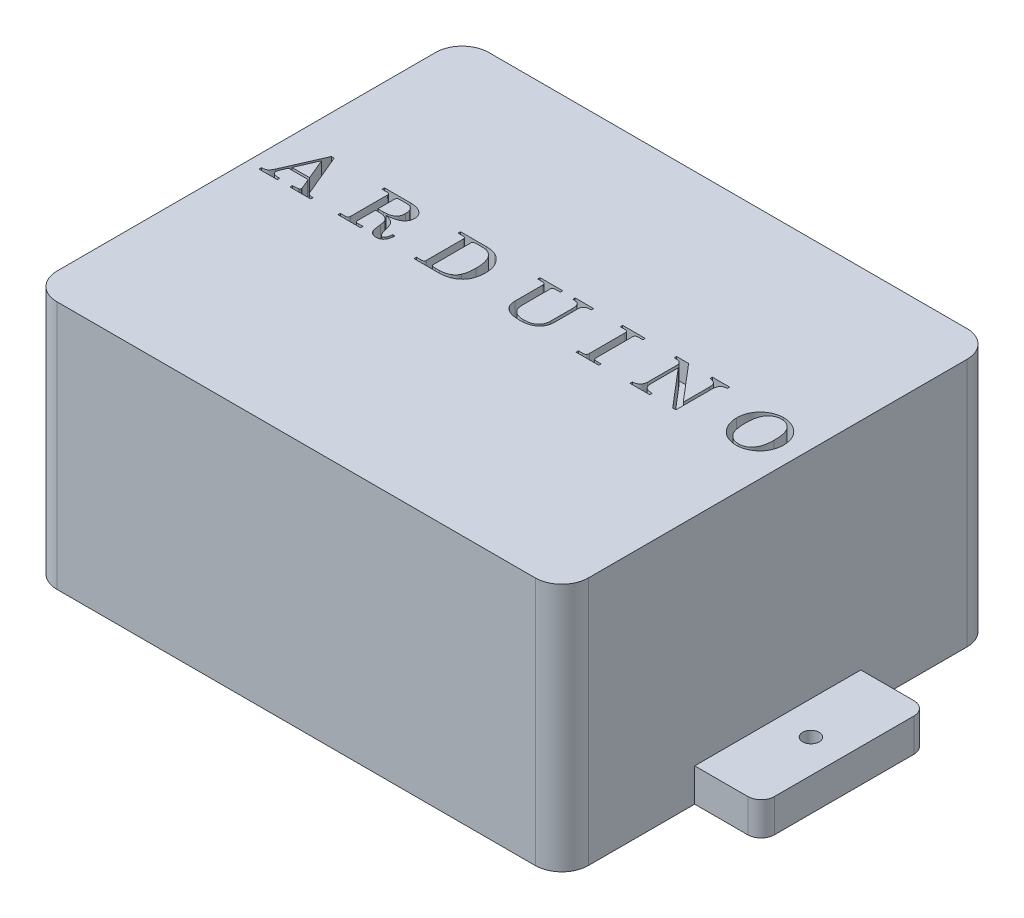
from build123d import *

# Parameters (mm, degrees)
SKETCH2_W           = 101.6
SKETCH2_H           = 82.55
BOSS_EXTRUDE1_DEPTH = 47.625
FILLET1_R           = 5.08
SKETCH4_W           = 12.7
SKETCH4_H           = 31.75
BOSS_EXTRUDE2_DEPTH = 6.35
SKETCH3_W           = 12.7
SKETCH3_H           = 31.75
BOSS_EXTRUDE3_DEPTH = 6.35
FILLET2_R           = 2.54
SKETCH5_W           = 31.75
SKETCH5_H           = 12.7
BOSS_EXTRUDE4_DEPTH = 6.35
FILLET3_R           = 2.54
SKETCH6_R           = 1.5875
CUT_EXTRUDE1_DEPTH  = 9.398
SKETCH7_R           = 1.5875
CUT_EXTRUDE2_DEPTH  = 9.398
SKETCH8_R           = 1.5875
CUT_EXTRUDE3_DEPTH  = 9.398
CUT_EXTRUDE4_DEPTH  = 3.81


with BuildPart() as part:
    # Sketch2 → Boss-Extrude1 (new body)
    with BuildSketch(Plane(origin=(0, 0, 0), x_dir=(1, 0, 0), z_dir=(0, 1, 0))):
        Rectangle(SKETCH2_W, SKETCH2_H)
    extrude(amount=BOSS_EXTRUDE1_DEPTH)

    # Fillet1
    fillet1_edges = [part.edges().sort_by_distance(p)[0] for p in [
        (-50.8, 23.8125, -41.275),
        (-50.8, 23.8125, 41.275),
        (50.8, 23.8125, 41.275),
        (50.8, 23.8125, -41.275),
    ]]
    fillet(fillet1_edges, radius=FILLET1_R)

    # Sketch4 → Boss-Extrude2 (add)
    with BuildSketch(Plane(origin=(0, 0, 0), x_dir=(1, 0, 0), z_dir=(0, 1, 0))):
        with Locations((-57.15, 0)):
            Rectangle(SKETCH4_W, SKETCH4_H)
    extrude(amount=BOSS_EXTRUDE2_DEPTH)

    # Sketch3 → Boss-Extrude3 (add)
    with BuildSketch(Plane(origin=(0, 0, 0), x_dir=(1, 0, 0), z_dir=(0, 1, 0))):
        with Locations((57.15, 0)):
            Rectangle(SKETCH3_W, SKETCH3_H)
    extrude(amount=BOSS_EXTRUDE3_DEPTH)

    # Fillet2
    fillet2_edges = [part.edges().sort_by_distance(p)[0] for p in [
        (-63.5, 3.175, -15.875),
        (-63.5, 3.175, 15.875),
        (63.5, 3.175, 15.875),
        (63.5, 3.175, -15.875),
    ]]
    fillet(fillet2_edges, radius=FILLET2_R)

    # Sketch5 → Boss-Extrude4 (add)
    with BuildSketch(Plane(origin=(0, 0, 0), x_dir=(1, 0, 0), z_dir=(0, 1, 0))):
        with Locations((0, 47.625)):
            Rectangle(SKETCH5_W, SKETCH5_H)
    extrude(amount=BOSS_EXTRUDE4_DEPTH)

    # Fillet3
    fillet3_edges = [part.edges().sort_by_distance(p)[0] for p in [
        (15.875, 3.175, -53.975),
        (-15.875, 3.175, -53.975),
    ]]
    fillet(fillet3_edges, radius=FILLET3_R)

    # Sketch6 → Cut-Extrude1 (cut)
    with BuildSketch(Plane(origin=(0, 6.35, 0), x_dir=(1, 0, 0), z_dir=(0, 1, 0))):
        with Locations(Location((0, 47.625, 0), (0, 0, 270))):
            Circle(SKETCH6_R)
    extrude(amount=-CUT_EXTRUDE1_DEPTH, mode=Mode.SUBTRACT)

    # Sketch7 → Cut-Extrude2 (cut)
    with BuildSketch(Plane(origin=(0, 6.35, 0), x_dir=(1, 0, 0), z_dir=(0, 1, 0))):
        with Locations(Location((-57.15, 0, 0), (0, 0, 270))):
            Circle(SKETCH7_R)
    extrude(amount=-CUT_EXTRUDE2_DEPTH, mode=Mode.SUBTRACT)

    # Sketch8 → Cut-Extrude3 (cut)
    with BuildSketch(Plane(origin=(0, 6.35, 0), x_dir=(1, 0, 0), z_dir=(0, 1, 0))):
        with Locations(Location((57.15, 0, 0), (0, 0, 270))):
            Circle(SKETCH8_R)
    extrude(amount=-CUT_EXTRUDE3_DEPTH, mode=Mode.SUBTRACT)

    # Sketch9 → Cut-Extrude4 (cut)
    # profile 1 of 7: a face of its own
    with BuildSketch(Plane(origin=(0, 47.625, 0), x_dir=(1, 0, 0), z_dir=(0, 1, 0))):
        with BuildLine():
            Line((-43.536424279, 9.003974359), (-42.989703526, 9.003974359))
            Line((-42.989703526, 9.003974359), (-39.622117388, 0.954535256))
            add(Edge.make_bspline(
                [(-39.622117388, 0.954535256), (-39.604002207, 0.914490083), (-39.5688485, 0.836779773), (-39.492223653, 0.736322955), (-39.407844046, 0.646018484), (-39.303777794, 0.578384667), (-39.190200079, 0.519918717), (-39.060178429, 0.485804808), (-38.918653338, 0.458207487), (-38.819118041, 0.456688218), (-38.767309696, 0.455897436)],
                knots=[0, 0, 0, 0, 0.994829911, 1.930533329, 2.855294756, 3.786422103, 4.733037038, 5.744176723, 6.825838908, 8, 8, 8, 8], degree=3))
            Line((-38.767309696, 0.455897436), (-38.466346154, 0.455897436))
            Line((-38.466346154, 0.455897436), (-38.466346154, 0))
            Line((-38.466346154, 0), (-42.455448718, 0))
            Line((-42.455448718, 0), (-42.455448718, 0.455897436))
            Line((-42.455448718, 0.455897436), (-42.136676683, 0.455897436))
            add(Edge.make_bspline(
                [(-42.136676683, 0.455897436), (-42.040411467, 0.456727966), (-41.862987376, 0.458258695), (-41.620429867, 0.481996759), (-41.420814343, 0.513991023), (-41.308710979, 0.557563734), (-41.258717949, 0.576995192)],
                knots=[0, 0, 0, 0, 1.294337848, 2.385562797, 3.280034022, 4, 4, 4, 4], degree=3))
            add(Edge.make_bspline(
                [(-41.258717949, 0.576995192), (-41.232122171, 0.591598971), (-41.181425583, 0.619436539), (-41.124537814, 0.682633624), (-41.087455546, 0.756805211), (-41.084120252, 0.811035153), (-41.082413862, 0.838780048)],
                knots=[0, 0, 0, 0, 1.083423217, 2.06520984, 3.010130791, 4, 4, 4, 4], degree=3))
            add(Edge.make_bspline(
                [(-41.082413862, 0.838780048), (-41.084970792, 0.874740677), (-41.090325562, 0.950050095), (-41.116710696, 1.02083813), (-41.130496795, 1.057824519)],
                knots=[0, 0, 0, 0, 0.955010143, 2, 2, 2, 2], degree=3))
            Line((-41.130496795, 1.057824519), (-41.926536458, 2.963333333))
            Line((-41.926536458, 2.963333333), (-45.694813702, 2.963333333))
            Line((-45.694813702, 2.963333333), (-46.173862179, 1.869891827))
            add(Edge.make_bspline(
                [(-46.173862179, 1.869891827), (-46.201088091, 1.80141011), (-46.251918871, 1.673554737), (-46.306931412, 1.488849421), (-46.34460872, 1.327062429), (-46.349645462, 1.225385744), (-46.351947115, 1.178922276)],
                knots=[0, 0, 0, 0, 1.231955945, 2.300061883, 3.2231747, 4, 4, 4, 4], degree=3))
            add(Edge.make_bspline(
                [(-46.351947115, 1.178922276), (-46.348066342, 1.130286407), (-46.340376604, 1.03391463), (-46.280592961, 0.895787578), (-46.18256579, 0.772425623), (-46.051157939, 0.658744225), (-45.881545579, 0.566388301), (-45.675991764, 0.502267979), (-45.438235852, 0.460954286), (-45.268196849, 0.457645452), (-45.178367388, 0.455897436)],
                knots=[0, 0, 0, 0, 0.762292442, 1.510479399, 2.32184449, 3.221058675, 4.222836197, 5.331659558, 6.5903494, 8, 8, 8, 8], degree=3))
            Line((-45.178367388, 0.455897436), (-44.848910256, 0.455897436))
            Line((-44.848910256, 0.455897436), (-44.848910256, 0))
            Line((-44.848910256, 0), (-48.382115385, 0))
            Line((-48.382115385, 0), (-48.382115385, 0.455897436))
            add(Edge.make_bspline(
                [(-48.382115385, 0.455897436), (-48.28815003, 0.45834966), (-48.109232276, 0.463018897), (-47.856196226, 0.505399238), (-47.633455259, 0.576064548), (-47.436060528, 0.678313489), (-47.259326621, 0.825133979), (-47.099990361, 1.022066475), (-46.940655653, 1.264167045), (-46.852919173, 1.450062102), (-46.806063702, 1.549338942)],
                knots=[0, 0, 0, 0, 1.090629389, 2.076647962, 2.968307612, 3.794769303, 4.642156667, 5.615757963, 6.72670086, 8, 8, 8, 8], degree=3))
            Line((-46.806063702, 1.549338942), (-43.536424279, 9.003974359))
        make_face()
        Polygon((-43.766153846, 7.36203125), (-45.493577724, 3.419230769), (-42.11708734, 3.419230769), align=None, mode=Mode.SUBTRACT)
    # profile 2 of 7: a face of its own
    with BuildSketch(Plane(origin=(0, 47.625, 0), x_dir=(1, 0, 0), z_dir=(0, 1, 0))):
        with BuildLine():
            Line((-33.280512821, 8.89), (-28.329751603, 8.89))
            add(Edge.make_bspline(
                [(-28.329751603, 8.89), (-28.213340327, 8.888523822), (-27.986676756, 8.885649566), (-27.65650361, 8.856654885), (-27.345707861, 8.80942446), (-27.055301867, 8.741677323), (-26.784754222, 8.657208281), (-26.535242629, 8.55095034), (-26.304495692, 8.427372869), (-26.09662607, 8.281880432), (-25.908721133, 8.12503902), (-25.747864924, 7.952061653), (-25.608917253, 7.769889459), (-25.495389293, 7.574643085), (-25.410117031, 7.365590905), (-25.347590337, 7.145926219), (-25.309065318, 6.914010907), (-25.30459087, 6.755504519), (-25.302307692, 6.674623397)],
                knots=[0, 0, 0, 0, 1.325337586, 2.580555424, 3.770824207, 4.902205483, 5.973254357, 6.993995562, 7.986110769, 8.948036827, 9.878475906, 10.767990268, 11.631887648, 12.48291557, 13.331523885, 14.195976461, 15.079460148, 16, 16, 16, 16], degree=3))
            add(Edge.make_bspline(
                [(-25.302307692, 6.674623397), (-25.306565576, 6.578149212), (-25.314931635, 6.388592905), (-25.376696516, 6.112147407), (-25.481543929, 5.852790412), (-25.626686554, 5.611426313), (-25.810893301, 5.390499895), (-26.031589015, 5.191177923), (-26.291445572, 5.019166852), (-26.533603961, 4.894128933), (-26.752425313, 4.807898642), (-26.940564903, 4.745406872), (-27.151706446, 4.691678618), (-27.383883414, 4.639863656), (-27.638593033, 4.591756713), (-27.916045669, 4.549679206), (-28.215324798, 4.512128559), (-28.422296121, 4.49252435), (-28.529206731, 4.482397837)],
                knots=[0, 0, 0, 0, 1.067088767, 2.096658329, 3.116436782, 4.150627256, 5.200286254, 6.288636011, 7.429161393, 8.639564393, 9.297052383, 10.030338999, 10.831780319, 11.706736611, 12.662696747, 13.69951255, 14.811687946, 16, 16, 16, 16], degree=3))
            add(Edge.make_bspline(
                [(-28.529206731, 4.482397837), (-28.455468641, 4.463271116), (-28.314081565, 4.426597112), (-28.112227106, 4.366344536), (-27.926617971, 4.311122903), (-27.76024501, 4.251909171), (-27.610977624, 4.194839042), (-27.479671223, 4.139001646), (-27.366250362, 4.081507677), (-27.239032646, 4.006465249), (-27.099526538, 3.903660233), (-26.949769136, 3.765870362), (-26.819710292, 3.609632254), (-26.723602186, 3.464275942), (-26.653470822, 3.330087637), (-26.597979506, 3.205888715), (-26.542292077, 3.058607602), (-26.482945766, 2.88834991), (-26.423363604, 2.695036089), (-26.361089626, 2.478158521), (-26.294841048, 2.239302661), (-26.253437116, 2.071241701), (-26.231911058, 1.983866186)],
                knots=[0, 0, 0, 0, 1.236432709, 2.370763958, 3.419256797, 4.37922064, 5.236377294, 6.013243618, 6.694123341, 7.298959475, 8.409090308, 9.500027509, 10.594363806, 11.700808435, 12.321479266, 13.050371871, 13.907528525, 14.876589473, 15.976806725, 17.190540236, 18.539351455, 20, 20, 20, 20], degree=3))
            add(Edge.make_bspline(
                [(-26.231911058, 1.983866186), (-26.20040644, 1.861638913), (-26.141475714, 1.63300761), (-26.033609919, 1.321309378), (-25.926469708, 1.058315167), (-25.834269957, 0.911407999), (-25.792041266, 0.844122596)],
                knots=[0, 0, 0, 0, 1.233367696, 2.307066631, 3.224614386, 4, 4, 4, 4], degree=3))
            add(Edge.make_bspline(
                [(-25.792041266, 0.844122596), (-25.76146001, 0.803013911), (-25.704667232, 0.726670531), (-25.603389792, 0.638786712), (-25.497097131, 0.581216745), (-25.422239609, 0.573571966), (-25.386007612, 0.569871795)],
                knots=[0, 0, 0, 0, 1.205711473, 2.239139682, 3.147721125, 4, 4, 4, 4], degree=3))
            add(Edge.make_bspline(
                [(-25.386007612, 0.569871795), (-25.348587458, 0.574132784), (-25.271033158, 0.582963802), (-25.159895613, 0.643734098), (-25.058566553, 0.742843215), (-24.979089928, 0.850021788), (-24.920004376, 0.956379423), (-24.879122515, 1.054523442), (-24.841994237, 1.166352335), (-24.8102445, 1.293197404), (-24.784352162, 1.434320206), (-24.760880738, 1.589239188), (-24.74324788, 1.758605549), (-24.736131933, 1.876387788), (-24.732435897, 1.937564103)],
                knots=[0, 0, 0, 0, 0.821559311, 1.702704273, 2.718209026, 3.921172205, 4.621965979, 5.387759944, 6.254196208, 7.209853525, 8.258997706, 9.406706446, 10.653038495, 12, 12, 12, 12], degree=3))
            Line((-24.732435897, 1.937564103), (-24.276538462, 1.937564103))
            add(Edge.make_bspline(
                [(-24.276538462, 1.937564103), (-24.282808592, 1.854968741), (-24.295021401, 1.694091495), (-24.326897952, 1.461553748), (-24.369747308, 1.244516198), (-24.422161392, 1.043651033), (-24.486912883, 0.858636438), (-24.560651217, 0.689394506), (-24.646988807, 0.535902243), (-24.744384233, 0.399217155), (-24.852795482, 0.27765451), (-24.971535589, 0.172614637), (-25.102323641, 0.084207185), (-25.242814594, 0.010357366), (-25.396164381, -0.043804498), (-25.558594491, -0.085905287), (-25.732667331, -0.108148586), (-25.85194247, -0.111998885), (-25.913139022, -0.113974359)],
                knots=[0, 0, 0, 0, 1.346462126, 2.622606342, 3.813111985, 4.94143984, 5.99444776, 6.99688579, 7.938971902, 8.852192047, 9.720181315, 10.581762286, 11.422275858, 12.281258439, 13.154436485, 14.060283573, 15.004788775, 16, 16, 16, 16], degree=3))
            add(Edge.make_bspline(
                [(-25.913139022, -0.113974359), (-25.989902468, -0.111255758), (-26.139234151, -0.105967131), (-26.355879723, -0.064260743), (-26.556323942, 0.005117309), (-26.74090832, 0.101992634), (-26.90525136, 0.227705853), (-27.049929148, 0.378942869), (-27.170800625, 0.558472948), (-27.231667306, 0.691759817), (-27.263022837, 0.760422676)],
                knots=[0, 0, 0, 0, 1.073046045, 2.087448933, 3.07206062, 4.030240904, 4.990002463, 5.953061936, 6.945517869, 8, 8, 8, 8], degree=3))
            add(Edge.make_bspline(
                [(-27.263022837, 0.760422676), (-27.275434131, 0.792893743), (-27.303897317, 0.867360592), (-27.337712553, 0.998276604), (-27.372416357, 1.16140789), (-27.412377641, 1.356987635), (-27.450480346, 1.585790911), (-27.489459077, 1.847122774), (-27.530417925, 2.140979908), (-27.557067471, 2.348319668), (-27.571109776, 2.457572115)],
                knots=[0, 0, 0, 0, 0.482554285, 1.106655889, 1.874902701, 2.79986758, 3.878891763, 5.096322143, 6.469980334, 8, 8, 8, 8], degree=3))
            add(Edge.make_bspline(
                [(-27.571109776, 2.457572115), (-27.579494093, 2.521764047), (-27.59560238, 2.645092171), (-27.627252966, 2.822305312), (-27.657235266, 2.985746066), (-27.695767707, 3.134526947), (-27.735555432, 3.26923789), (-27.780258401, 3.389397408), (-27.827947226, 3.495047077), (-27.896920531, 3.616920629), (-28.002325794, 3.753257371), (-28.155938606, 3.897874501), (-28.341909806, 4.022609268), (-28.553198553, 4.133170163), (-28.791956364, 4.221434542), (-29.05368441, 4.284741067), (-29.337058268, 4.325073707), (-29.533461816, 4.328995726), (-29.635114183, 4.331025641)],
                knots=[0, 0, 0, 0, 0.982635714, 1.887879316, 2.732700714, 3.504264558, 4.219851532, 4.864317877, 5.449055353, 5.977774836, 6.987156041, 8.051828256, 9.166693456, 10.375944424, 11.664877114, 13.020033355, 14.457661972, 16, 16, 16, 16], degree=3))
            Line((-29.635114183, 4.331025641), (-30.431153846, 4.331025641))
            Line((-30.431153846, 4.331025641), (-30.431153846, 0.877958734))
            add(Edge.make_bspline(
                [(-30.431153846, 0.877958734), (-30.430211121, 0.843926931), (-30.42844794, 0.780277148), (-30.404701754, 0.69315065), (-30.368055558, 0.619819003), (-30.330199594, 0.584986851), (-30.311836939, 0.568090946)],
                knots=[0, 0, 0, 0, 1.184932624, 2.216183006, 3.134730392, 4, 4, 4, 4], degree=3))
            add(Edge.make_bspline(
                [(-30.311836939, 0.568090946), (-30.284033213, 0.549984359), (-30.224262562, 0.511059992), (-30.113134623, 0.481678536), (-29.984563955, 0.458663939), (-29.891713184, 0.456866013), (-29.841692708, 0.455897436)],
                knots=[0, 0, 0, 0, 0.806637898, 1.73405794, 2.779293934, 4, 4, 4, 4], degree=3))
            Line((-29.841692708, 0.455897436), (-28.949487179, 0.455897436))
            Line((-28.949487179, 0.455897436), (-28.949487179, 0))
            Line((-28.949487179, 0), (-33.280512821, 0))
            Line((-33.280512821, 0), (-33.280512821, 0.455897436))
            Line((-33.280512821, 0.455897436), (-32.377622196, 0.455897436))
            add(Edge.make_bspline(
                [(-32.377622196, 0.455897436), (-32.331239913, 0.457137352), (-32.243850884, 0.459473483), (-32.122900591, 0.479626371), (-32.021100193, 0.515356427), (-31.939158818, 0.565875895), (-31.874628588, 0.628796126), (-31.831833866, 0.704579388), (-31.802964011, 0.789239648), (-31.800261776, 0.849796481), (-31.798846154, 0.881520433)],
                knots=[0, 0, 0, 0, 1.366320197, 2.574288932, 3.598095376, 4.525274064, 5.391179792, 6.222279922, 7.068704523, 8, 8, 8, 8], degree=3))
            Line((-31.798846154, 0.881520433), (-31.798846154, 7.978205128))
            add(Edge.make_bspline(
                [(-31.798846154, 7.978205128), (-31.80038642, 8.013983669), (-31.803311214, 8.081923118), (-31.829893015, 8.177704503), (-31.877686165, 8.257710354), (-31.941912548, 8.32423997), (-32.025226111, 8.375000461), (-32.126653575, 8.409522285), (-32.24614707, 8.430832484), (-32.331812401, 8.432963172), (-32.377622196, 8.434102564)],
                knots=[0, 0, 0, 0, 1.019835337, 1.936553289, 2.80224376, 3.652720564, 4.550463343, 5.557701521, 6.693973527, 8, 8, 8, 8], degree=3))
            Line((-32.377622196, 8.434102564), (-33.280512821, 8.434102564))
            Line((-33.280512821, 8.434102564), (-33.280512821, 8.89))
        make_face()
        with BuildLine():
            Line((-30.431153846, 4.786923077), (-29.343054888, 4.786923077))
            add(Edge.make_bspline(
                [(-29.343054888, 4.786923077), (-29.254587816, 4.788581977), (-29.082223527, 4.791814085), (-28.830504157, 4.808454931), (-28.594146317, 4.841497063), (-28.371596876, 4.882519852), (-28.165156473, 4.940892462), (-27.971498476, 5.006541634), (-27.795095868, 5.090256936), (-27.630427377, 5.181584321), (-27.483551586, 5.291755026), (-27.356364099, 5.422805219), (-27.249050026, 5.573560637), (-27.161975135, 5.744222354), (-27.093795013, 5.933299333), (-27.047023173, 6.142105201), (-27.015582953, 6.369738764), (-27.013170025, 6.528479251), (-27.011923077, 6.610512821)],
                knots=[0, 0, 0, 0, 1.2479382, 2.431412908, 3.555094835, 4.612540209, 5.620016077, 6.5785745, 7.492548499, 8.37005512, 9.230745153, 10.071494986, 10.935761083, 11.830708422, 12.765610627, 13.762771068, 14.843849608, 16, 16, 16, 16], degree=3))
            add(Edge.make_bspline(
                [(-27.011923077, 6.610512821), (-27.014178507, 6.721692239), (-27.018468727, 6.93317486), (-27.063181423, 7.23205609), (-27.134357768, 7.495159376), (-27.236454487, 7.721880249), (-27.364797569, 7.911013997), (-27.507361865, 8.072896472), (-27.67414881, 8.196013007), (-27.828860346, 8.275431282), (-27.970320441, 8.321932232), (-28.100426074, 8.351375917), (-28.252553656, 8.377753508), (-28.427916554, 8.398783663), (-28.625809767, 8.413880604), (-28.846648351, 8.426683585), (-29.090724048, 8.433546492), (-29.261132042, 8.433911717), (-29.350178285, 8.434102564)],
                knots=[0, 0, 0, 0, 1.523576127, 2.898107215, 4.132521921, 5.250819719, 6.289334486, 7.257415311, 8.193517659, 9.114527787, 9.629347882, 10.23154437, 10.942154632, 11.745834806, 12.652342215, 13.663311778, 14.778969804, 16, 16, 16, 16], degree=3))
            add(Edge.make_bspline(
                [(-29.350178285, 8.434102564), (-29.408348783, 8.433544666), (-29.518764782, 8.432485694), (-29.676225023, 8.430425762), (-29.815658354, 8.420484251), (-29.938192301, 8.410924962), (-30.042593885, 8.396137828), (-30.131250551, 8.381670178), (-30.201595058, 8.360745297), (-30.271207437, 8.331039788), (-30.336097825, 8.278574915), (-30.393351691, 8.2003346), (-30.426292227, 8.102279154), (-30.429459616, 8.031885969), (-30.431153846, 7.994232772)],
                knots=[0, 0, 0, 0, 1.586941608, 3.012244179, 4.294006373, 5.399370131, 6.363466356, 7.170168388, 7.846384482, 8.360988235, 9.225882761, 10.084234759, 10.975260392, 12, 12, 12, 12], degree=3))
            Line((-30.431153846, 7.994232772), (-30.431153846, 4.786923077))
        make_face(mode=Mode.SUBTRACT)
    # profile 3 of 7: a face of its own
    with BuildSketch(Plane(origin=(0, 47.625, 0), x_dir=(1, 0, 0), z_dir=(0, 1, 0))):
        with BuildLine():
            Line((-18.748782051, 8.89), (-13.739252804, 8.89))
            add(Edge.make_bspline(
                [(-13.739252804, 8.89), (-13.647801009, 8.889200098), (-13.46886916, 8.887635033), (-13.205684337, 8.868720391), (-12.953069872, 8.840871286), (-12.710606263, 8.801550318), (-12.478321535, 8.752628806), (-12.25705173, 8.689037771), (-12.044758201, 8.618225409), (-11.910480428, 8.558075411), (-11.844429087, 8.52848758)],
                knots=[0, 0, 0, 0, 1.128854498, 2.20868295, 3.255962748, 4.265640905, 5.240237995, 6.184520583, 7.106964267, 8, 8, 8, 8], degree=3))
            add(Edge.make_bspline(
                [(-11.844429087, 8.52848758), (-11.764108127, 8.488942416), (-11.603347847, 8.409793815), (-11.374708691, 8.264626301), (-11.154220823, 8.103233893), (-10.942199852, 7.922302791), (-10.742624471, 7.720272285), (-10.547986832, 7.502433458), (-10.366146938, 7.262994157), (-10.191007456, 7.008422719), (-10.03397199, 6.736683761), (-9.892717304, 6.452945456), (-9.778961102, 6.154459564), (-9.680837748, 5.845868166), (-9.609289793, 5.523762666), (-9.555458982, 5.190267628), (-9.522799077, 4.843966956), (-9.518859758, 4.608907922), (-9.516858974, 4.489521234)],
                knots=[0, 0, 0, 0, 0.873369389, 1.748025758, 2.639281441, 3.539309685, 4.4653202, 5.409464513, 6.388818265, 7.398141486, 8.423799729, 9.450030714, 10.488442667, 11.538606627, 12.608347628, 13.705790979, 14.834769239, 16, 16, 16, 16], degree=3))
            add(Edge.make_bspline(
                [(-9.516858974, 4.489521234), (-9.518522432, 4.390367682), (-9.521802152, 4.194873802), (-9.538960616, 3.905329254), (-9.571538138, 3.623727845), (-9.615777275, 3.349106526), (-9.672971211, 3.081684859), (-9.741582823, 2.821455665), (-9.82590628, 2.569878366), (-9.890690447, 2.406833674), (-9.922892628, 2.325789263)],
                knots=[0, 0, 0, 0, 1.073908748, 2.117348133, 3.139660485, 4.14264811, 5.128659546, 6.100166453, 7.055652226, 8, 8, 8, 8], degree=3))
            add(Edge.make_bspline(
                [(-9.922892628, 2.325789263), (-9.978156182, 2.204935017), (-10.088672236, 1.963250696), (-10.308025133, 1.626558325), (-10.56804271, 1.313606871), (-10.867305899, 1.025032344), (-11.205149402, 0.765875645), (-11.580172858, 0.541446626), (-11.989038139, 0.348619635), (-12.280152468, 0.253357463), (-12.428547676, 0.204797676)],
                knots=[0, 0, 0, 0, 0.938742659, 1.87729757, 2.831356061, 3.811095414, 4.811112603, 5.835599115, 6.896699036, 8, 8, 8, 8], degree=3))
            add(Edge.make_bspline(
                [(-12.428547676, 0.204797676), (-12.488335048, 0.1880899), (-12.611269704, 0.153735408), (-12.805389293, 0.113801746), (-13.013137489, 0.077725146), (-13.23611178, 0.050260061), (-13.47296358, 0.026608278), (-13.724230875, 0.010955348), (-13.989698093, 0.00239672), (-14.171399395, 0.000812585), (-14.264603365, 0)],
                knots=[0, 0, 0, 0, 0.803661782, 1.652487486, 2.564925393, 3.533654074, 4.560912339, 5.647000953, 6.793025422, 8, 8, 8, 8], degree=3))
            Line((-14.264603365, 0), (-18.748782051, 0))
            Line((-18.748782051, 0), (-18.748782051, 0.455897436))
            Line((-18.748782051, 0.455897436), (-17.861919071, 0.455897436))
            add(Edge.make_bspline(
                [(-17.861919071, 0.455897436), (-17.810240206, 0.457402621), (-17.715427654, 0.460164107), (-17.585056663, 0.476089177), (-17.479879456, 0.507390837), (-17.396532324, 0.552059156), (-17.336930196, 0.61464906), (-17.295067298, 0.689287504), (-17.272183203, 0.778727444), (-17.268881725, 0.842212446), (-17.267115385, 0.876177885)],
                knots=[0, 0, 0, 0, 1.479128524, 2.713680912, 3.745072478, 4.604546806, 5.38523546, 6.183642314, 7.028221118, 8, 8, 8, 8], degree=3))
            Line((-17.267115385, 0.876177885), (-17.267115385, 8.026288061))
            add(Edge.make_bspline(
                [(-17.267115385, 8.026288061), (-17.268994562, 8.055490513), (-17.27267177, 8.112634366), (-17.296496385, 8.194797901), (-17.34464531, 8.264194175), (-17.405471344, 8.325478654), (-17.482185361, 8.375664776), (-17.574314014, 8.408762105), (-17.678639077, 8.430791616), (-17.753157775, 8.432959185), (-17.792465946, 8.434102564)],
                knots=[0, 0, 0, 0, 0.937952034, 1.835400481, 2.701595091, 3.617244345, 4.59439305, 5.612970742, 6.740856268, 8, 8, 8, 8], degree=3))
            Line((-17.792465946, 8.434102564), (-18.748782051, 8.434102564))
            Line((-18.748782051, 8.434102564), (-18.748782051, 8.89))
        make_face()
        with BuildLine():
            add(Edge.make_bspline(
                [(-15.325989583, 8.434102564), (-15.371798299, 8.432960938), (-15.457461615, 8.430826071), (-15.576968235, 8.409543078), (-15.678354143, 8.374935116), (-15.761445986, 8.324665441), (-15.824617311, 8.258040516), (-15.867619039, 8.176645391), (-15.895225419, 8.082065349), (-15.897975054, 8.014032733), (-15.899423077, 7.978205128)],
                knots=[0, 0, 0, 0, 1.310688048, 2.451015729, 3.461849022, 4.362796097, 5.2045471, 6.056534608, 6.976524584, 8, 8, 8, 8], degree=3))
            Line((-15.899423077, 7.978205128), (-15.899423077, 0.893986378))
            add(Edge.make_bspline(
                [(-15.899423077, 0.893986378), (-15.897548614, 0.859857722), (-15.89397792, 0.794845485), (-15.861729221, 0.703959625), (-15.811401314, 0.624843285), (-15.736142672, 0.560166479), (-15.635683637, 0.511908287), (-15.508635306, 0.480274227), (-15.354599491, 0.458935675), (-15.242379095, 0.456963241), (-15.181740785, 0.455897436)],
                knots=[0, 0, 0, 0, 0.856306403, 1.6311921, 2.397824084, 3.191915919, 4.093923673, 5.177590192, 6.474910384, 8, 8, 8, 8], degree=3))
            Line((-15.181740785, 0.455897436), (-14.360769231, 0.455897436))
            add(Edge.make_bspline(
                [(-14.360769231, 0.455897436), (-14.270498306, 0.457884176), (-14.092632555, 0.461798758), (-13.829508091, 0.484559495), (-13.574922743, 0.525746779), (-13.328599346, 0.582787715), (-13.090548104, 0.655162154), (-12.862961378, 0.747387326), (-12.641418968, 0.851414139), (-12.502072305, 0.935479106), (-12.432109375, 0.977686298)],
                knots=[0, 0, 0, 0, 1.069971775, 2.108224046, 3.127228152, 4.123885653, 5.103057016, 6.072448486, 7.032218285, 8, 8, 8, 8], degree=3))
            add(Edge.make_bspline(
                [(-12.432109375, 0.977686298), (-12.344922135, 1.039062337), (-12.171028178, 1.161476147), (-11.950326493, 1.395142869), (-11.757095313, 1.658604293), (-11.660446414, 1.856295048), (-11.611137821, 1.957153446)],
                knots=[0, 0, 0, 0, 0.985415046, 1.965399071, 2.96198186, 4, 4, 4, 4], degree=3))
            add(Edge.make_bspline(
                [(-11.611137821, 1.957153446), (-11.579641808, 2.030893058), (-11.514576092, 2.183227286), (-11.438114577, 2.428046975), (-11.37204221, 2.692040689), (-11.319514467, 2.976498454), (-11.276634373, 3.280647527), (-11.24696895, 3.605730257), (-11.228942674, 3.950902322), (-11.227311787, 4.187940923), (-11.226474359, 4.309655449)],
                knots=[0, 0, 0, 0, 0.80120648, 1.655164237, 2.56053185, 3.520798587, 4.545578828, 5.630395886, 6.783256233, 8, 8, 8, 8], degree=3))
            add(Edge.make_bspline(
                [(-11.226474359, 4.309655449), (-11.228578785, 4.488410063), (-11.232653287, 4.834507327), (-11.271972622, 5.334696974), (-11.336721373, 5.798366191), (-11.428994198, 6.224562934), (-11.54494911, 6.615182788), (-11.690156706, 6.968054155), (-11.857964273, 7.28710858), (-11.998626137, 7.472906673), (-12.067035256, 7.563267228)],
                knots=[0, 0, 0, 0, 1.253239079, 2.426469483, 3.515491727, 4.533593932, 5.481684897, 6.368298549, 7.206442619, 8, 8, 8, 8], degree=3))
            add(Edge.make_bspline(
                [(-12.067035256, 7.563267228), (-12.128701447, 7.633392286), (-12.251439897, 7.772967001), (-12.468996083, 7.949554725), (-12.707128348, 8.099715836), (-12.96790185, 8.224275601), (-13.252578974, 8.317317433), (-13.558611197, 8.384570748), (-13.887110007, 8.426283103), (-14.113696675, 8.43143878), (-14.230767228, 8.434102564)],
                knots=[0, 0, 0, 0, 0.927471519, 1.846010217, 2.774815188, 3.722955891, 4.712549021, 5.746842689, 6.835861021, 8, 8, 8, 8], degree=3))
            Line((-14.230767228, 8.434102564), (-15.325989583, 8.434102564))
        make_face(mode=Mode.SUBTRACT)
    # profile 4 of 7: a face of its own
    with BuildSketch(Plane(origin=(0, 47.625, 0), x_dir=(1, 0, 0), z_dir=(0, 1, 0))):
        with BuildLine():
            Line((-3.533205128, 8.89), (0.797820513, 8.89))
            Line((0.797820513, 8.89), (0.797820513, 8.434102564))
            Line((0.797820513, 8.434102564), (-0.062329728, 8.434102564))
            add(Edge.make_bspline(
                [(-0.062329728, 8.434102564), (-0.115798261, 8.432735144), (-0.214256181, 8.430217153), (-0.350206987, 8.412516459), (-0.460224727, 8.377700279), (-0.547279764, 8.328903243), (-0.610549978, 8.263404114), (-0.654691672, 8.183685142), (-0.678794783, 8.089393621), (-0.682109977, 8.022264885), (-0.683846154, 7.987109375)],
                knots=[0, 0, 0, 0, 1.457371901, 2.683630832, 3.722116912, 4.584977252, 5.374344441, 6.170971849, 7.042132742, 8, 8, 8, 8], degree=3))
            Line((-0.683846154, 7.987109375), (-0.683846154, 2.879633413))
            add(Edge.make_bspline(
                [(-0.683846154, 2.879633413), (-0.683671799, 2.814921194), (-0.683334167, 2.68960859), (-0.675975276, 2.507284293), (-0.664224163, 2.337328499), (-0.645605823, 2.179490392), (-0.625503145, 2.034233397), (-0.598413193, 1.901115625), (-0.566995241, 1.780344867), (-0.541213937, 1.704733966), (-0.52891226, 1.668655849)],
                knots=[0, 0, 0, 0, 1.26598702, 2.451532826, 3.569443726, 4.598059717, 5.560557243, 6.437477292, 7.25443453, 8, 8, 8, 8], degree=3))
            add(Edge.make_bspline(
                [(-0.52891226, 1.668655849), (-0.509146458, 1.618922891), (-0.469941543, 1.52027896), (-0.393166841, 1.380373439), (-0.306588226, 1.24735545), (-0.208378924, 1.121495487), (-0.096166414, 1.005443623), (0.025785422, 0.895088574), (0.160832159, 0.793281624), (0.306413168, 0.698323439), (0.465340894, 0.615129391), (0.635078037, 0.542213871), (0.81566162, 0.478905577), (1.009194332, 0.430757444), (1.213167602, 0.388001853), (1.430202106, 0.363771313), (1.657612538, 0.344110254), (1.813448979, 0.342662514), (1.893042869, 0.341923077)],
                knots=[0, 0, 0, 0, 0.870361103, 1.72633687, 2.591965376, 3.452130061, 4.32007431, 5.216382593, 6.126592765, 7.069994713, 8.042488186, 9.042247806, 10.075078372, 11.153110645, 12.286284334, 13.464375872, 14.704923022, 16, 16, 16, 16], degree=3))
            add(Edge.make_bspline(
                [(1.893042869, 0.341923077), (2.002921145, 0.344166531), (2.215934739, 0.348515763), (2.525567545, 0.376530249), (2.815305357, 0.425545998), (3.084649556, 0.497721044), (3.335741852, 0.585017781), (3.565017015, 0.696777641), (3.774838804, 0.82637564), (3.962777363, 0.977482641), (4.129913674, 1.144197152), (4.274877825, 1.325625463), (4.400155615, 1.519132371), (4.498254505, 1.728396237), (4.578882403, 1.949658277), (4.632165282, 2.18546957), (4.667710648, 2.433931892), (4.671179158, 2.604065061), (4.672948718, 2.690863381)],
                knots=[0, 0, 0, 0, 1.278948243, 2.479410588, 3.615362396, 4.694698649, 5.721884643, 6.704603805, 7.657477578, 8.586581247, 9.505116446, 10.399689619, 11.285224436, 12.18147716, 13.084099542, 14.02098127, 14.990346785, 16, 16, 16, 16], degree=3))
            Line((4.672948718, 2.690863381), (4.672948718, 6.843804087))
            add(Edge.make_bspline(
                [(4.672948718, 6.843804087), (4.671801298, 6.929888319), (4.66964712, 7.091503743), (4.65725021, 7.31769288), (4.630838479, 7.51051689), (4.595231398, 7.673258135), (4.550338578, 7.811036291), (4.49680198, 7.931032372), (4.432617849, 8.034105555), (4.360327916, 8.12411854), (4.277062721, 8.198961746), (4.185358001, 8.264188018), (4.082787637, 8.317635424), (3.965897237, 8.361950018), (3.823957914, 8.397031046), (3.647664059, 8.417161551), (3.432528652, 8.431463148), (3.276202963, 8.433173466), (3.191282051, 8.434102564)],
                knots=[0, 0, 0, 0, 1.595289402, 2.995012738, 4.194377291, 5.197759292, 6.077799386, 6.875254456, 7.626136128, 8.321901517, 9.007065315, 9.693728476, 10.402245455, 11.143804078, 12.005505098, 13.103818099, 14.426705109, 16, 16, 16, 16], degree=3))
            Line((3.191282051, 8.434102564), (3.191282051, 8.89))
            Line((3.191282051, 8.89), (6.724487179, 8.89))
            Line((6.724487179, 8.89), (6.724487179, 8.434102564))
            Line((6.724487179, 8.434102564), (6.462702324, 8.434102564))
            add(Edge.make_bspline(
                [(6.462702324, 8.434102564), (6.412800766, 8.433026636), (6.316348644, 8.430947031), (6.176492083, 8.416411904), (6.04658373, 8.393763606), (5.925918763, 8.36183739), (5.814896092, 8.319758363), (5.715247804, 8.264931124), (5.622656673, 8.205324046), (5.516100269, 8.109068488), (5.403002402, 7.965824984), (5.307850068, 7.759214804), (5.253392611, 7.519137977), (5.246471626, 7.348670696), (5.242820513, 7.258741987)],
                knots=[0, 0, 0, 0, 0.926262674, 1.79032488, 2.607434735, 3.371949735, 4.104587355, 4.804677008, 5.480135518, 6.143622011, 7.461964485, 8.837380035, 10.331584045, 12, 12, 12, 12], degree=3))
            Line((5.242820513, 7.258741987), (5.242820513, 2.918812099))
            add(Edge.make_bspline(
                [(5.242820513, 2.918812099), (5.240081339, 2.803528146), (5.234754186, 2.57932358), (5.193629083, 2.253590407), (5.124548289, 1.948475233), (5.026424369, 1.66427994), (4.901253051, 1.399676311), (4.747204855, 1.156220778), (4.565263085, 0.932923767), (4.423557282, 0.803863587), (4.352395833, 0.739052484)],
                knots=[0, 0, 0, 0, 1.136692078, 2.210642051, 3.231720009, 4.216663715, 5.169830349, 6.111839143, 7.051808325, 8, 8, 8, 8], degree=3))
            add(Edge.make_bspline(
                [(4.352395833, 0.739052484), (4.267039625, 0.670764251), (4.095439443, 0.533477538), (3.812267038, 0.359165389), (3.508060074, 0.212991958), (3.183867047, 0.094255538), (2.840057761, -0.001868636), (2.474236624, -0.064977388), (2.088790507, -0.10832477), (1.824904781, -0.112063433), (1.690026042, -0.113974359)],
                knots=[0, 0, 0, 0, 0.918044137, 1.845636599, 2.78729075, 3.750195265, 4.743923444, 5.783209084, 6.8669415, 8, 8, 8, 8], degree=3))
            add(Edge.make_bspline(
                [(1.690026042, -0.113974359), (1.573055549, -0.113201008), (1.346092066, -0.111700438), (1.015261966, -0.092899672), (0.703223668, -0.065386341), (0.410049071, -0.025152825), (0.136179554, 0.028744954), (-0.118416092, 0.092333739), (-0.354622357, 0.166216338), (-0.571366558, 0.254468152), (-0.771991519, 0.352563661), (-0.957725261, 0.46146851), (-1.129548336, 0.580102071), (-1.284687189, 0.712359182), (-1.429505302, 0.849672133), (-1.559086543, 0.999177964), (-1.673302026, 1.159231248), (-1.737892319, 1.273300715), (-1.770164263, 1.330294471)],
                knots=[0, 0, 0, 0, 1.422495068, 2.760135736, 4.028896878, 5.231706749, 6.357393975, 7.422061231, 8.422174171, 9.364702629, 10.265577661, 11.136083296, 11.981310976, 12.801276094, 13.613159394, 14.406467317, 15.203806119, 16, 16, 16, 16], degree=3))
            add(Edge.make_bspline(
                [(-1.770164263, 1.330294471), (-1.814048564, 1.423581775), (-1.904676925, 1.616235527), (-1.987504162, 1.938004403), (-2.042856578, 2.291191996), (-2.048562489, 2.538648862), (-2.051538462, 2.66771234)],
                knots=[0, 0, 0, 0, 0.895223759, 1.848785523, 2.878013669, 4, 4, 4, 4], degree=3))
            Line((-2.051538462, 2.66771234), (-2.051538462, 7.997794471))
            add(Edge.make_bspline(
                [(-2.051538462, 7.997794471), (-2.052953928, 8.030079592), (-2.055689997, 8.092486094), (-2.08515705, 8.180025662), (-2.133663453, 8.255482199), (-2.198932444, 8.321268549), (-2.284636105, 8.372650593), (-2.388426987, 8.410338517), (-2.510822203, 8.430471081), (-2.598190186, 8.432843427), (-2.644561298, 8.434102564)],
                knots=[0, 0, 0, 0, 0.928188755, 1.794170572, 2.625108498, 3.496485892, 4.441718532, 5.481404, 6.66323918, 8, 8, 8, 8], degree=3))
            Line((-2.644561298, 8.434102564), (-3.533205128, 8.434102564))
            Line((-3.533205128, 8.434102564), (-3.533205128, 8.89))
        make_face()
    # profile 5 of 7: a face of its own
    with BuildSketch(Plane(origin=(0, 47.625, 0), x_dir=(1, 0, 0), z_dir=(0, 1, 0))):
        with BuildLine():
            Line((12.25224359, 8.89), (16.583269231, 8.89))
            Line((16.583269231, 8.89), (16.583269231, 8.434102564))
            Line((16.583269231, 8.434102564), (15.849559295, 8.434102564))
            add(Edge.make_bspline(
                [(15.849559295, 8.434102564), (15.775321155, 8.433027477), (15.641886352, 8.431095128), (15.462690078, 8.411536585), (15.327552224, 8.377462217), (15.226452233, 8.324485877), (15.167346807, 8.236974181), (15.126909139, 8.126976561), (15.106735058, 7.984209547), (15.103419832, 7.879104528), (15.101602564, 7.821490385)],
                knots=[0, 0, 0, 0, 1.531563451, 2.752815006, 3.706607585, 4.403890848, 5.043163299, 5.830073504, 6.810537727, 8, 8, 8, 8], degree=3))
            Line((15.101602564, 7.821490385), (15.101602564, 1.098784054))
            add(Edge.make_bspline(
                [(15.101602564, 1.098784054), (15.102502251, 1.038038839), (15.104132357, 0.927976998), (15.12578399, 0.783054284), (15.15329154, 0.668544663), (15.195521684, 0.617075924), (15.213796074, 0.594803686)],
                knots=[0, 0, 0, 0, 1.379910147, 2.500204358, 3.350988468, 4, 4, 4, 4], degree=3))
            add(Edge.make_bspline(
                [(15.213796074, 0.594803686), (15.243162623, 0.572923054), (15.307078052, 0.525300503), (15.434163726, 0.486427761), (15.587152922, 0.459699615), (15.699790507, 0.457229272), (15.760516827, 0.455897436)],
                knots=[0, 0, 0, 0, 0.759472056, 1.652968592, 2.734644564, 4, 4, 4, 4], degree=3))
            Line((15.760516827, 0.455897436), (16.583269231, 0.455897436))
            Line((16.583269231, 0.455897436), (16.583269231, 0))
            Line((16.583269231, 0), (12.25224359, 0))
            Line((12.25224359, 0), (12.25224359, 0.455897436))
            Line((12.25224359, 0.455897436), (13.058968349, 0.455897436))
            add(Edge.make_bspline(
                [(13.058968349, 0.455897436), (13.123739235, 0.456804961), (13.241334168, 0.45845262), (13.399167742, 0.480256186), (13.520445918, 0.515914848), (13.614346401, 0.569276384), (13.672726364, 0.659303219), (13.709299445, 0.776211095), (13.731379971, 0.926436951), (13.73301141, 1.037560271), (13.733910256, 1.098784054)],
                knots=[0, 0, 0, 0, 1.384495799, 2.513624624, 3.392764078, 4.083001615, 4.766200516, 5.625225214, 6.691609504, 8, 8, 8, 8], degree=3))
            Line((13.733910256, 1.098784054), (13.733910256, 7.821490385))
            add(Edge.make_bspline(
                [(13.733910256, 7.821490385), (13.733077518, 7.879890108), (13.731583138, 7.984690569), (13.709687638, 8.121793358), (13.682402499, 8.229434723), (13.639999204, 8.275384688), (13.621716747, 8.295196314)],
                knots=[0, 0, 0, 0, 1.401324038, 2.51472778, 3.359615216, 4, 4, 4, 4], degree=3))
            add(Edge.make_bspline(
                [(13.621716747, 8.295196314), (13.587468233, 8.317005358), (13.511064986, 8.365658032), (13.36404451, 8.406394275), (13.182680792, 8.429615178), (13.049580311, 8.432519758), (12.977049279, 8.434102564)],
                knots=[0, 0, 0, 0, 0.72446111, 1.616163013, 2.700965197, 4, 4, 4, 4], degree=3))
            Line((12.977049279, 8.434102564), (12.25224359, 8.434102564))
            Line((12.25224359, 8.434102564), (12.25224359, 8.89))
        make_face()
    # profile 6 of 7: a face of its own
    with BuildSketch(Plane(origin=(0, 47.625, 0), x_dir=(1, 0, 0), z_dir=(0, 1, 0))):
        with BuildLine():
            Line((22.566923077, 8.89), (24.876684696, 8.89))
            Line((24.876684696, 8.89), (30.773076923, 1.966057692))
            Line((30.773076923, 1.966057692), (30.773076923, 6.970244391))
            add(Edge.make_bspline(
                [(30.773076923, 6.970244391), (30.772321234, 7.031440749), (30.770864997, 7.149368134), (30.752124044, 7.320125534), (30.724251733, 7.478587921), (30.685593226, 7.625613162), (30.634188207, 7.760353032), (30.568840704, 7.881942001), (30.495651879, 7.993633911), (30.435673614, 8.057337064), (30.406221955, 8.088617788)],
                knots=[0, 0, 0, 0, 1.215165716, 2.341664129, 3.408042055, 4.409243659, 5.35751363, 6.264863958, 7.147980766, 8, 8, 8, 8], degree=3))
            add(Edge.make_bspline(
                [(30.406221955, 8.088617788), (30.377221625, 8.115579231), (30.318754025, 8.169936228), (30.217066452, 8.237081287), (30.106964216, 8.295992192), (29.986382906, 8.344507846), (29.855420181, 8.381146615), (29.71446555, 8.410022688), (29.563078128, 8.427221941), (29.458849218, 8.431769749), (29.405384615, 8.434102564)],
                knots=[0, 0, 0, 0, 0.874863457, 1.763813279, 2.686384845, 3.635232624, 4.633007156, 5.691775484, 6.815987758, 8, 8, 8, 8], degree=3))
            Line((29.405384615, 8.434102564), (29.405384615, 8.89))
            Line((29.405384615, 8.89), (32.710641026, 8.89))
            Line((32.710641026, 8.89), (32.710641026, 8.434102564))
            add(Edge.make_bspline(
                [(32.710641026, 8.434102564), (32.632259862, 8.432185228), (32.485795984, 8.428602474), (32.280389621, 8.408106818), (32.107326158, 8.365031144), (31.958636857, 8.309024088), (31.8349422, 8.222747138), (31.720143282, 8.115960828), (31.616966932, 7.979154876), (31.521873843, 7.820776269), (31.441997708, 7.644864945), (31.386068308, 7.456621784), (31.347788841, 7.260880589), (31.344577973, 7.127146199), (31.342948718, 7.059286859)],
                knots=[0, 0, 0, 0, 1.273620412, 2.379900693, 3.34334979, 4.165161923, 4.943339328, 5.775549224, 6.703211447, 7.715179268, 8.772476955, 9.830829215, 10.899322028, 12, 12, 12, 12], degree=3))
            Line((31.342948718, 7.059286859), (31.342948718, 0))
            Line((31.342948718, 0), (30.719651442, 0))
            Line((30.719651442, 0), (24.618461538, 7.164356971))
            Line((24.618461538, 7.164356971), (24.618461538, 1.887700321))
            add(Edge.make_bspline(
                [(24.618461538, 1.887700321), (24.619854031, 1.830052353), (24.622561274, 1.717974845), (24.642775511, 1.555416982), (24.673250786, 1.403294315), (24.721288256, 1.26398913), (24.776327102, 1.133493404), (24.851478185, 1.01814651), (24.935244489, 0.911121313), (25.033761377, 0.815882594), (25.14790468, 0.734703812), (25.272993989, 0.659781049), (25.414964913, 0.600354163), (25.57023024, 0.551237069), (25.739004053, 0.509658072), (25.922343536, 0.47962293), (26.120612288, 0.462762004), (26.257407966, 0.458235723), (26.328076923, 0.455897436)],
                knots=[0, 0, 0, 0, 1.083543807, 2.106594452, 3.076323729, 3.993978111, 4.873368367, 5.731102151, 6.5730049, 7.425494339, 8.296129267, 9.201552721, 10.161469547, 11.181532642, 12.261621997, 13.426764906, 14.670660919, 16, 16, 16, 16], degree=3))
            Line((26.328076923, 0.455897436), (26.328076923, 0))
            Line((26.328076923, 0), (22.566923077, 0))
            Line((22.566923077, 0), (22.566923077, 0.455897436))
            add(Edge.make_bspline(
                [(22.566923077, 0.455897436), (22.622205319, 0.458546301), (22.730842547, 0.463751687), (22.888835097, 0.48688927), (23.037659726, 0.522758563), (23.177470152, 0.569613662), (23.309771718, 0.625247322), (23.431421971, 0.696664157), (23.546501044, 0.775525776), (23.649023248, 0.869664782), (23.743301088, 0.969279892), (23.823572739, 1.077791063), (23.893584068, 1.189880895), (23.951471834, 1.307690413), (23.993261215, 1.432030294), (24.026638602, 1.560301794), (24.043624856, 1.6949225), (24.046917374, 1.786154507), (24.048589744, 1.83249399)],
                knots=[0, 0, 0, 0, 1.176690621, 2.312359281, 3.390340899, 4.428468477, 5.446436319, 6.436215521, 7.424059985, 8.407618418, 9.39036607, 10.337341353, 11.27288392, 12.199006596, 13.1214208, 14.058495788, 15.013851547, 16, 16, 16, 16], degree=3))
            Line((24.048589744, 1.83249399), (24.048589744, 7.835737179))
            Line((24.048589744, 7.835737179), (23.936396234, 7.963958333))
            add(Edge.make_bspline(
                [(23.936396234, 7.963958333), (23.893535944, 8.013095129), (23.815615831, 8.102425945), (23.703902534, 8.21704662), (23.60966618, 8.300995877), (23.546337846, 8.335765225), (23.519677484, 8.350402644)],
                knots=[0, 0, 0, 0, 1.368088109, 2.487187542, 3.36312665, 4, 4, 4, 4], degree=3))
            add(Edge.make_bspline(
                [(23.519677484, 8.350402644), (23.484968422, 8.363926919), (23.41286637, 8.392021252), (23.292467316, 8.414771977), (23.159249594, 8.431638255), (23.065036285, 8.433255578), (23.015697115, 8.434102564)],
                knots=[0, 0, 0, 0, 0.86773493, 1.802568742, 2.849213177, 4, 4, 4, 4], degree=3))
            Line((23.015697115, 8.434102564), (22.566923077, 8.434102564))
            Line((22.566923077, 8.434102564), (22.566923077, 8.89))
        make_face()
    # profile 7 of 7: a face of its own
    with BuildSketch(Plane(origin=(0, 47.625, 0), x_dir=(1, 0, 0), z_dir=(0, 1, 0))):
        with BuildLine():
            add(Edge.make_bspline(
                [(42.882852564, 9.003974359), (42.984412329, 9.002241182), (43.186104235, 8.99879919), (43.486637593, 8.97181742), (43.781286383, 8.924748579), (44.072017624, 8.863223272), (44.357040581, 8.780048677), (44.638659644, 8.681779457), (44.913194603, 8.560123435), (45.183889261, 8.426607814), (45.443235615, 8.273874429), (45.691340225, 8.108366491), (45.921952176, 7.925018028), (46.142910669, 7.732736987), (46.343784276, 7.519931063), (46.533186975, 7.295858742), (46.708186172, 7.057030799), (46.865745023, 6.803973297), (47.008885145, 6.541216087), (47.131475689, 6.267536816), (47.236854647, 5.986394628), (47.322837489, 5.696646684), (47.387963248, 5.398862591), (47.436544341, 5.093338071), (47.465699914, 4.779185848), (47.468767899, 4.566752721), (47.470320513, 4.459246795)],
                knots=[0, 0, 0, 0, 1.013991872, 2.013730084, 3.009648154, 3.99201617, 4.978791006, 5.972378118, 6.967819845, 7.975102566, 8.984562821, 9.970928137, 10.950341279, 11.924467159, 12.892859805, 13.868823287, 14.852817164, 15.846139048, 16.843326253, 17.838150159, 18.837818086, 19.839294288, 20.853147561, 21.879262856, 22.926759614, 24, 24, 24, 24], degree=3))
            add(Edge.make_bspline(
                [(47.470320513, 4.459246795), (47.468783502, 4.351737383), (47.465746348, 4.139297367), (47.436365322, 3.825195515), (47.388596421, 3.519356463), (47.320251623, 3.221574027), (47.235116029, 2.93036608), (47.130144989, 2.646928694), (47.004765664, 2.372518798), (46.862766359, 2.106707937), (46.702306913, 1.853747853), (46.529940792, 1.611372734), (46.340260579, 1.386044432), (46.138838679, 1.172244215), (45.92082361, 0.974915299), (45.68965547, 0.791301272), (45.443433587, 0.623103787), (45.1856519, 0.468947408), (44.917248662, 0.333075117), (44.644898871, 0.212606296), (44.367041061, 0.113402837), (44.086315165, 0.028854219), (43.800666274, -0.035593037), (43.511278569, -0.078716078), (43.218314614, -0.109589057), (43.021246895, -0.112505864), (42.92203125, -0.113974359)],
                knots=[0, 0, 0, 0, 1.076310259, 2.126803254, 3.155853627, 4.173909243, 5.183950743, 6.19204886, 7.197585098, 8.202857758, 9.207216151, 10.195348551, 11.178659758, 12.154124192, 13.134556531, 14.120451532, 15.108065306, 16.118316678, 17.125853845, 18.11869506, 19.098334228, 20.078189778, 21.05303824, 22.02739727, 23.006874119, 24, 24, 24, 24], degree=3))
            add(Edge.make_bspline(
                [(42.92203125, -0.113974359), (42.825205622, -0.112310863), (42.632964555, -0.1090081), (42.346913726, -0.081023428), (42.065215092, -0.037637788), (41.789089088, 0.027740107), (41.517099987, 0.107773307), (41.249000845, 0.205623368), (40.986329422, 0.324014026), (40.727844833, 0.456556747), (40.479017064, 0.607640578), (40.24229043, 0.775678134), (40.015964649, 0.95731511), (39.805597279, 1.157618976), (39.6038466, 1.369996472), (39.417676301, 1.59972703), (39.244375025, 1.845446703), (39.083327948, 2.103781684), (38.936318179, 2.37329705), (38.813246969, 2.65372423), (38.704583602, 2.939616314), (38.618216751, 3.233299616), (38.549516536, 3.534169152), (38.502988095, 3.841973991), (38.470259181, 4.156986112), (38.467660782, 4.369524264), (38.466346154, 4.477055288)],
                knots=[0, 0, 0, 0, 0.978187785, 1.942129042, 2.901655734, 3.856144519, 4.807007646, 5.765333662, 6.737359399, 7.716576547, 8.699003499, 9.675921472, 10.648317293, 11.628544368, 12.608771444, 13.606479754, 14.613377771, 15.645317302, 16.68127607, 17.712378469, 18.737373663, 19.769818632, 20.802995178, 21.853268449, 22.913887979, 24, 24, 24, 24], degree=3))
            add(Edge.make_bspline(
                [(38.466346154, 4.477055288), (38.467849593, 4.582790398), (38.470828304, 4.792279681), (38.500914631, 5.102635518), (38.546133137, 5.405623466), (38.612127208, 5.700250625), (38.698337857, 5.986097583), (38.801885535, 6.264436886), (38.922458735, 6.535819847), (39.063611465, 6.79695892), (39.220310441, 7.047746984), (39.390252253, 7.286825683), (39.577313822, 7.509404699), (39.77455606, 7.721367092), (39.988889451, 7.916405711), (40.215437626, 8.098460184), (40.455113982, 8.267311054), (40.708453941, 8.418341183), (40.969295463, 8.555471754), (41.234689991, 8.674643929), (41.502722592, 8.776830231), (41.77320754, 8.860700689), (42.04684988, 8.925664717), (42.323264469, 8.968551594), (42.601967621, 8.999553534), (42.788974682, 9.002496823), (42.882852564, 9.003974359)],
                knots=[0, 0, 0, 0, 1.081780254, 2.143293465, 3.188055771, 4.215327256, 5.230128541, 6.241213527, 7.252809401, 8.266628285, 9.276343545, 10.277745834, 11.265586078, 12.249758214, 13.238699968, 14.228257287, 15.222632624, 16.236360497, 17.244484545, 18.23696523, 19.211793152, 20.178332606, 21.133193716, 22.086991345, 23.039666199, 24, 24, 24, 24], degree=3))
        make_face()
        with BuildLine():
            add(Edge.make_bspline(
                [(42.987922676, 8.548076923), (42.885627871, 8.545767365), (42.684684674, 8.541230575), (42.39162714, 8.492894222), (42.113415924, 8.418155793), (41.848894387, 8.314957138), (41.600958006, 8.178296266), (41.367216321, 8.012990912), (41.149316644, 7.817526155), (40.946345885, 7.591926877), (40.763917862, 7.331745495), (40.604302152, 7.03500944), (40.472374831, 6.699649278), (40.362100089, 6.327898455), (40.277542407, 5.91797278), (40.218385915, 5.471029387), (40.182882304, 4.986359639), (40.178325862, 4.651047621), (40.175961538, 4.477055288)],
                knots=[0, 0, 0, 0, 0.876613054, 1.721978258, 2.539553034, 3.344089237, 4.150620373, 4.961430389, 5.794332297, 6.655989744, 7.558548564, 8.512987582, 9.53873671, 10.643724721, 11.834918627, 13.124451022, 14.507886846, 16, 16, 16, 16], degree=3))
            add(Edge.make_bspline(
                [(40.175961538, 4.477055288), (40.1767993, 4.38147877), (40.178443959, 4.193846833), (40.186813999, 3.917680385), (40.203384571, 3.65291389), (40.223883993, 3.399205846), (40.252927203, 3.15762407), (40.285930215, 2.926948831), (40.327552836, 2.707992333), (40.372966762, 2.499130035), (40.426678943, 2.30207914), (40.484978396, 2.1156972), (40.550978405, 1.941752426), (40.621945893, 1.778385049), (40.700739589, 1.627181218), (40.784133546, 1.485569553), (40.874607682, 1.355739983), (41.002700862, 1.200280678), (41.172835433, 1.026325496), (41.391391798, 0.843442486), (41.620934648, 0.687283072), (41.864133358, 0.561824835), (42.118497304, 0.463453255), (42.384480323, 0.391536804), (42.663111223, 0.35033142), (42.852444536, 0.344757902), (42.94874399, 0.341923077)],
                knots=[0, 0, 0, 0, 1.220059187, 2.395170635, 3.526264384, 4.606093651, 5.643730328, 6.631763494, 7.579941029, 8.488126044, 9.359397868, 10.186170738, 10.979921594, 11.733141808, 12.458400527, 13.154946637, 13.829720281, 14.475892752, 15.724421181, 16.929398184, 18.108412047, 19.260703626, 20.414588624, 21.583601028, 22.770961653, 24, 24, 24, 24], degree=3))
            add(Edge.make_bspline(
                [(42.94874399, 0.341923077), (43.016445259, 0.343580021), (43.149701358, 0.346841377), (43.34685504, 0.364048375), (43.537722778, 0.396715568), (43.722930572, 0.4408017), (43.901491361, 0.498008489), (44.073923633, 0.5675059), (44.238691006, 0.651730194), (44.398797547, 0.746485723), (44.552502466, 0.854610857), (44.696582665, 0.980106668), (44.83300245, 1.120071804), (44.960732474, 1.275570053), (45.082068142, 1.444766494), (45.194839798, 1.62913329), (45.297217827, 1.829276737), (45.393895041, 2.043441933), (45.482044857, 2.273594016), (45.555415914, 2.521669182), (45.620635985, 2.786450543), (45.670620243, 3.069229731), (45.712274783, 3.3685333), (45.739635568, 3.685362998), (45.7583341, 4.019150087), (45.7599029, 4.247891557), (45.760705128, 4.364861779)],
                knots=[0, 0, 0, 0, 0.878668368, 1.729478945, 2.565267725, 3.389187559, 4.197952966, 4.996121204, 5.798774297, 6.596682309, 7.40885198, 8.233491646, 9.072362894, 9.942242492, 10.84216141, 11.772202074, 12.743742231, 13.757365924, 14.820307135, 15.938816868, 17.112084143, 18.357046377, 19.663200865, 21.032169209, 22.482357281, 24, 24, 24, 24], degree=3))
            add(Edge.make_bspline(
                [(45.760705128, 4.364861779), (45.759756728, 4.491915706), (45.757912308, 4.739006223), (45.741452965, 5.098910563), (45.715978438, 5.438286725), (45.676118697, 5.755306625), (45.629511355, 6.051733175), (45.567979618, 6.32529054), (45.500458594, 6.579563014), (45.41703231, 6.811936919), (45.326351753, 7.027645527), (45.224492268, 7.22723593), (45.114041266, 7.412965079), (44.995317966, 7.584568417), (44.865453615, 7.740078771), (44.72935635, 7.883991687), (44.579745201, 8.010048114), (44.423693366, 8.124548493), (44.259417687, 8.223265653), (44.092212934, 8.311228647), (43.91979641, 8.385332687), (43.741788156, 8.443141784), (43.559771259, 8.48964215), (43.373660645, 8.524061197), (43.18245485, 8.543586711), (43.053263146, 8.546568727), (42.987922676, 8.548076923)],
                knots=[0, 0, 0, 0, 1.612491314, 3.135922848, 4.571887507, 5.930668905, 7.190356697, 8.378575155, 9.488058158, 10.527022218, 11.50939919, 12.45623191, 13.368469419, 14.250493536, 15.10133201, 15.937906979, 16.760833695, 17.580650453, 18.392115718, 19.190783436, 19.977275628, 20.770666376, 21.563735095, 22.360267714, 23.170682992, 24, 24, 24, 24], degree=3))
        make_face(mode=Mode.SUBTRACT)
    extrude(amount=-CUT_EXTRUDE4_DEPTH, mode=Mode.SUBTRACT)


solid = part.part
